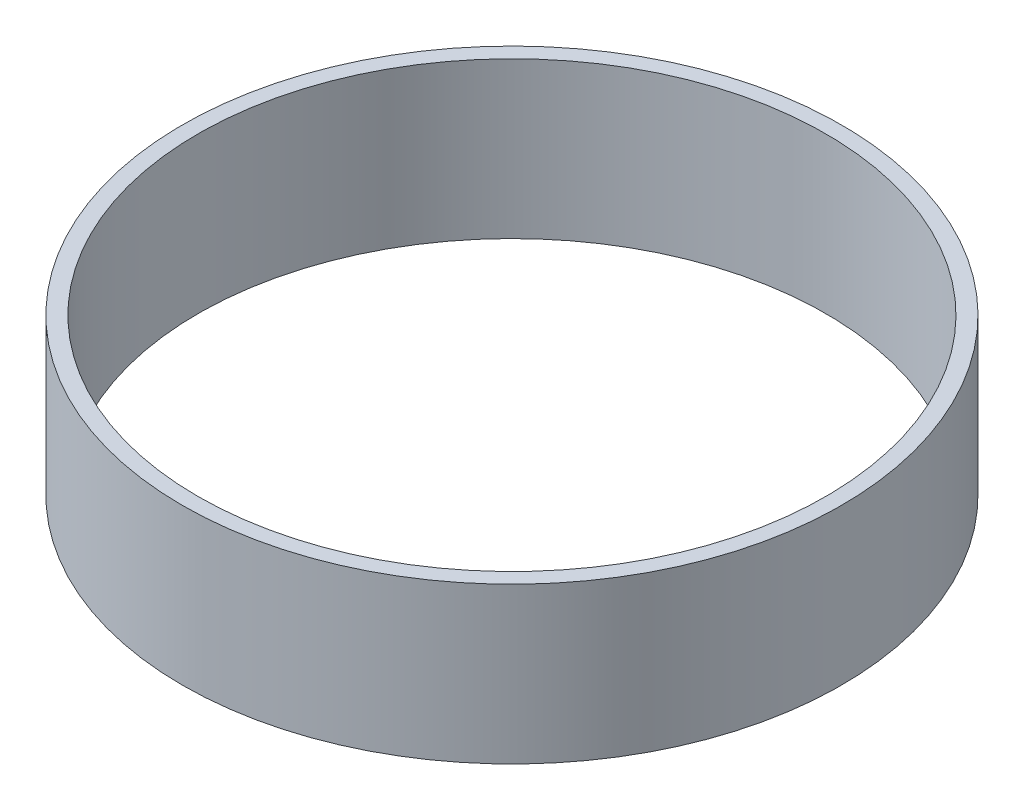
from build123d import *

# Parameters (mm, degrees)
SKETCH1_R           = 31.75
SKETCH1_R_2         = 30.25
BOSS_EXTRUDE1_DEPTH = 7.5


with BuildPart() as part:
    # Sketch1 → Boss-Extrude1 (new, symmetric)
    with BuildSketch(Plane(origin=(0, 0, 0), x_dir=(1, 0, 0), z_dir=(0, 1, 0))):
        with Locations(Location((0, 0, 0), (0, 0, 270))):
            Circle(SKETCH1_R)
        with Locations(Location((0, 0, 0), (0, 0, 270))):
            Circle(SKETCH1_R_2, mode=Mode.SUBTRACT)
    extrude(amount=BOSS_EXTRUDE1_DEPTH, both=True)


solid = part.part
